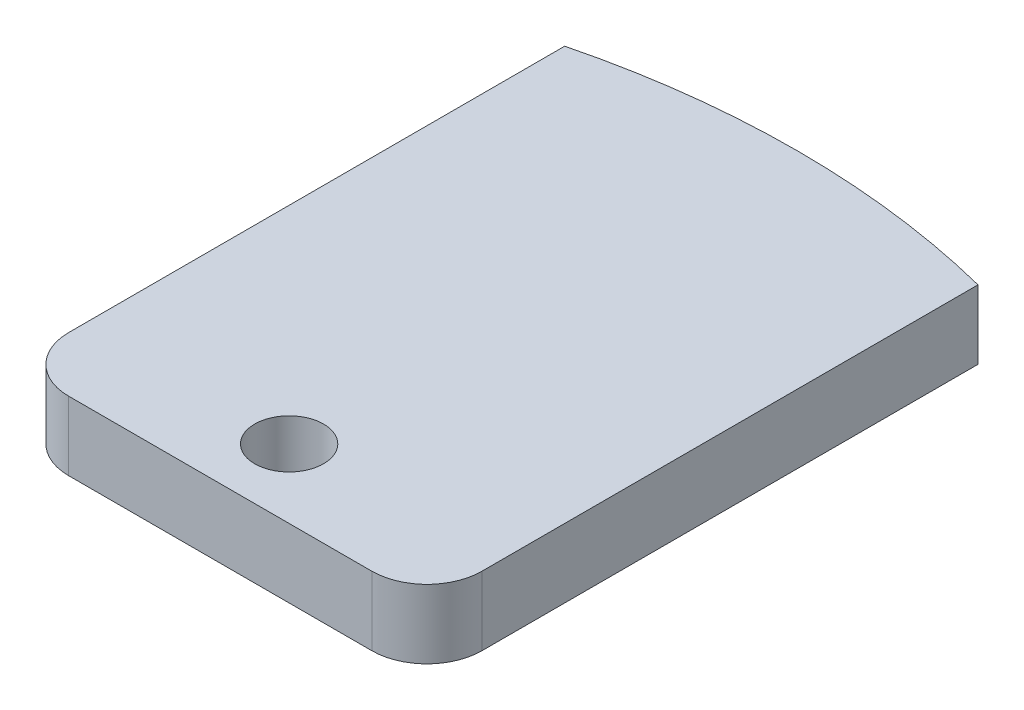
from build123d import *

# Parameters (mm, degrees)
SKETCH2_R           = 3.175
BOSS_EXTRUDE1_DEPTH = 3.175


with BuildPart() as part:
    # Sketch2 → Boss-Extrude1 (new, symmetric)
    with BuildSketch(Plane(origin=(0, 0, 0), x_dir=(1, 0, 0), z_dir=(0, 1, 0))):
        with BuildLine():
            ThreePointArc((-19.05, -20.32), (-17.562102448, -23.912102448), (-13.97, -25.4))
            Line((-13.97, -25.4), (13.97, -25.4))
            ThreePointArc((13.97, -25.4), (17.562102448, -23.912102448), (19.05, -20.32))
            Line((19.05, -20.32), (19.05, 25.4))
            ThreePointArc((19.05, 25.4), (0, 27.773915087), (-19.05, 25.4))
            Line((-19.05, 25.4), (-19.05, -20.32))
        make_face()
        with Locations(Location((0, -19.05, 0), (0, 0, 270))):
            Circle(SKETCH2_R, mode=Mode.SUBTRACT)
    extrude(amount=BOSS_EXTRUDE1_DEPTH, both=True)


solid = part.part
